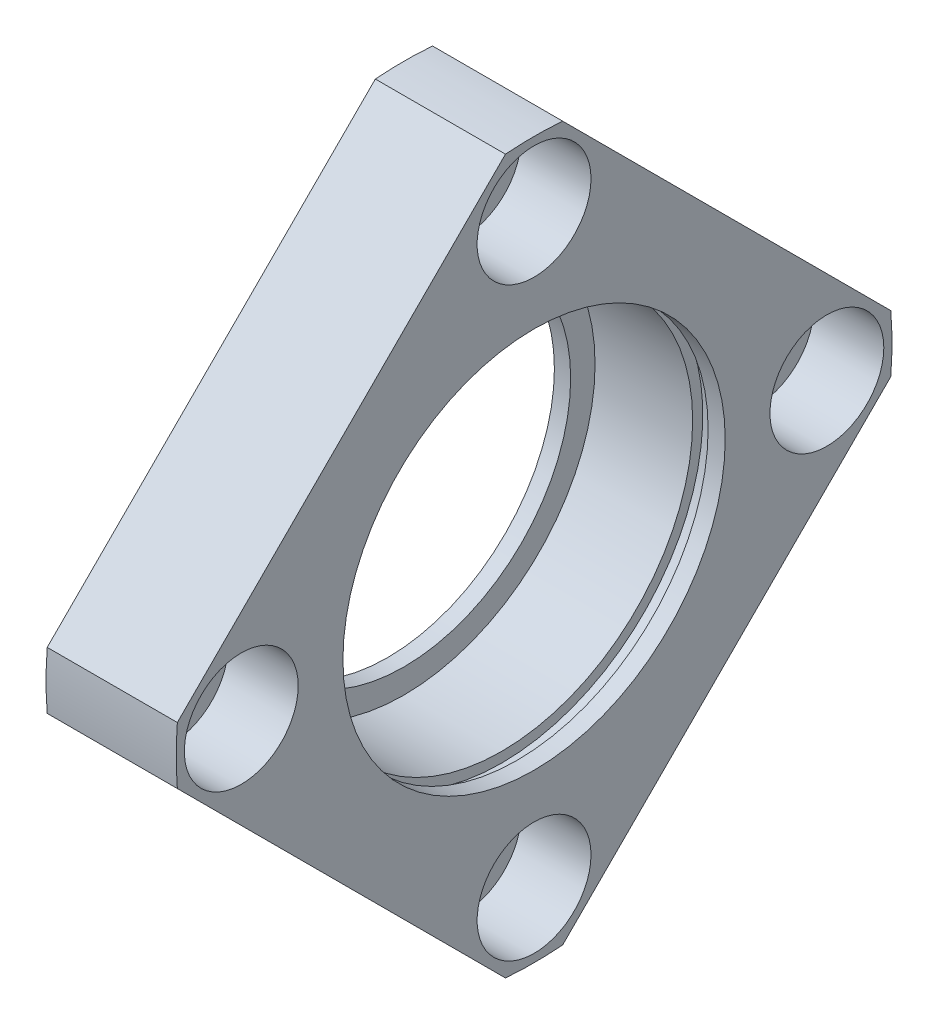
from build123d import *

# Parameters (mm, degrees)
FILLET1_R            = 0.3
DIAMETER_HOLE1_D     = 14
DIAMETER_HOLE1_DEPTH = 8.6
TAPPED_HOLE1_D       = 8.5
CUT_EXTRUDE1_DEPTH   = 65.249513617


with BuildPart() as part:
    # Sketch1 → Revolve1 (revolve)
    with BuildSketch(Plane.XY):
        Polygon((0, 44), (-16, 44), (-16, 27), (-18, 27), (-18, 20.5), (-16, 20.5), (-16, 23.5), (-4, 23.5), (-4, 24.75), (-2.1, 24.75), (-2.1, 23.5), (0, 23.5), align=None)
    revolve(axis=Axis((0, 0, 0), (-1, 0, 0)))

    # Fillet1
    fillet1_edges = [part.edges().sort_by_distance(p)[0] for p in [
        (-16, -27, 0),
    ]]
    fillet(fillet1_edges, radius=FILLET1_R)

    # Diameter Hole1
    with Locations(Plane(origin=(0, 0, 0), x_dir=(0, 0, -1), z_dir=(1, 0, 0))):
        with Locations((0, 36), (-36, 0), (36, 0), (0, -36)):
            Hole(DIAMETER_HOLE1_D / 2, depth=DIAMETER_HOLE1_DEPTH)

    # Tapped Hole1 (through all)
    with Locations(Plane(origin=(-8.6, 0, 0), x_dir=(0, 0, -1), z_dir=(1, 0, 0))):
        with Locations((0, 36), (-36, 0), (0, -36), (36, 0)):
            Hole(TAPPED_HOLE1_D / 2)

    # Sketch6 → Cut-Extrude1 (cut, through all)
    with BuildSketch(Plane(origin=(-16, 0, 0), x_dir=(0, 0, -1), z_dir=(1, 0, 0))):
        with BuildLine():
            Line((-43.859219924, 3.516934416), (-3.516934416, 43.859219924))
            ThreePointArc((-3.516934416, 43.859219924), (-31.112698372, 31.112698372), (-43.859219924, 3.516934416))
        make_face()
        with BuildLine():
            Line((3.516934416, 43.859219924), (43.859219924, 3.516934416))
            ThreePointArc((43.859219924, 3.516934416), (31.112698372, 31.112698372), (3.516934416, 43.859219924))
        make_face()
        with BuildLine():
            Line((43.859219924, -3.516934416), (3.516934416, -43.859219924))
            ThreePointArc((3.516934416, -43.859219924), (31.112698372, -31.112698372), (43.859219924, -3.516934416))
        make_face()
        with BuildLine():
            Line((-3.516934416, -43.859219924), (-43.859219924, -3.516934416))
            ThreePointArc((-43.859219924, -3.516934416), (-31.112698372, -31.112698372), (-3.516934416, -43.859219924))
        make_face()
    extrude(amount=CUT_EXTRUDE1_DEPTH, mode=Mode.SUBTRACT)


solid = part.part
